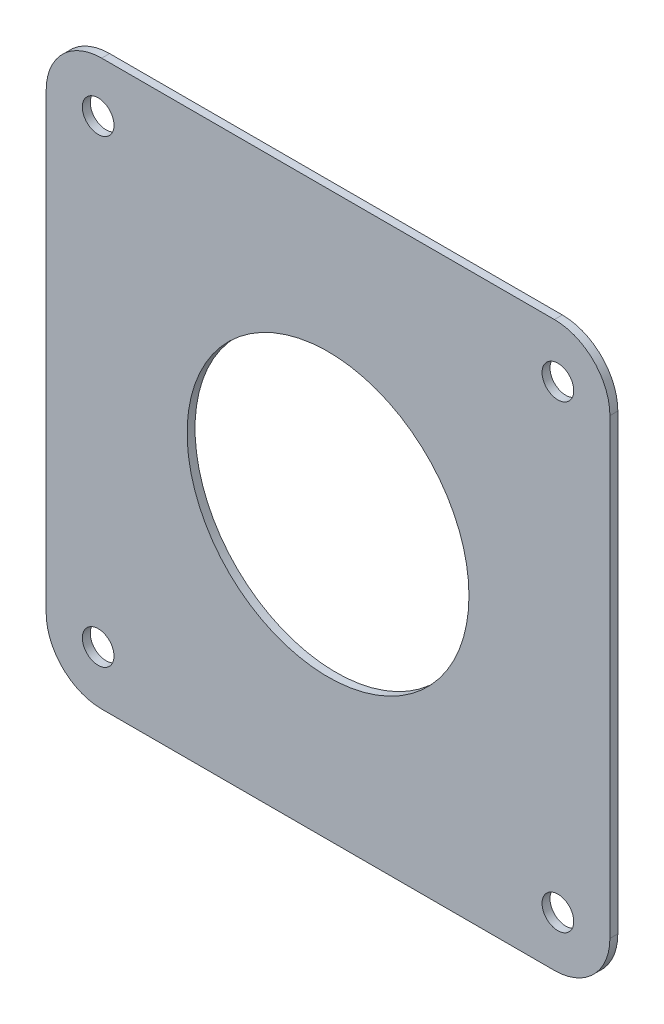
from build123d import *

# Parameters (mm, degrees)
SKETCH1_R           = 17.78
SKETCH1_R_2         = 2
BOSS_EXTRUDE1_DEPTH = 1


with BuildPart() as part:
    # Sketch1 → Boss-Extrude1 (new body)
    with BuildSketch(Plane(origin=(0, 0, 0), x_dir=(0, 1, 0), z_dir=(0, 0, 1))):
        with BuildLine():
            Line((-28.56, -35.56), (28.56, -35.56))
            ThreePointArc((28.56, -35.56), (33.509747468, -33.509747468), (35.56, -28.56))
            Line((35.56, -28.56), (35.56, 28.56))
            ThreePointArc((35.56, 28.56), (33.509747468, 33.509747468), (28.56, 35.56))
            Line((28.56, 35.56), (-28.56, 35.56))
            ThreePointArc((-28.56, 35.56), (-33.509747468, 33.509747468), (-35.56, 28.56))
            Line((-35.56, 28.56), (-35.56, -28.56))
            ThreePointArc((-35.56, -28.56), (-33.509747468, -33.509747468), (-28.56, -35.56))
        make_face()
        with Locations(Location((0, 0, 0), (0, 0, 270))):
            Circle(SKETCH1_R, mode=Mode.SUBTRACT)
        with Locations(Location((-29, 29, 0), (0, 0, 270))):
            Circle(SKETCH1_R_2, mode=Mode.SUBTRACT)
        with Locations(Location((29, -29, 0), (0, 0, 90))):
            Circle(SKETCH1_R_2, mode=Mode.SUBTRACT)
        with Locations(Location((29, 29, 0), (0, 0, 270))):
            Circle(SKETCH1_R_2, mode=Mode.SUBTRACT)
        with Locations(Location((-29, -29, 0), (0, 0, 90))):
            Circle(SKETCH1_R_2, mode=Mode.SUBTRACT)
    extrude(amount=BOSS_EXTRUDE1_DEPTH)


solid = part.part
